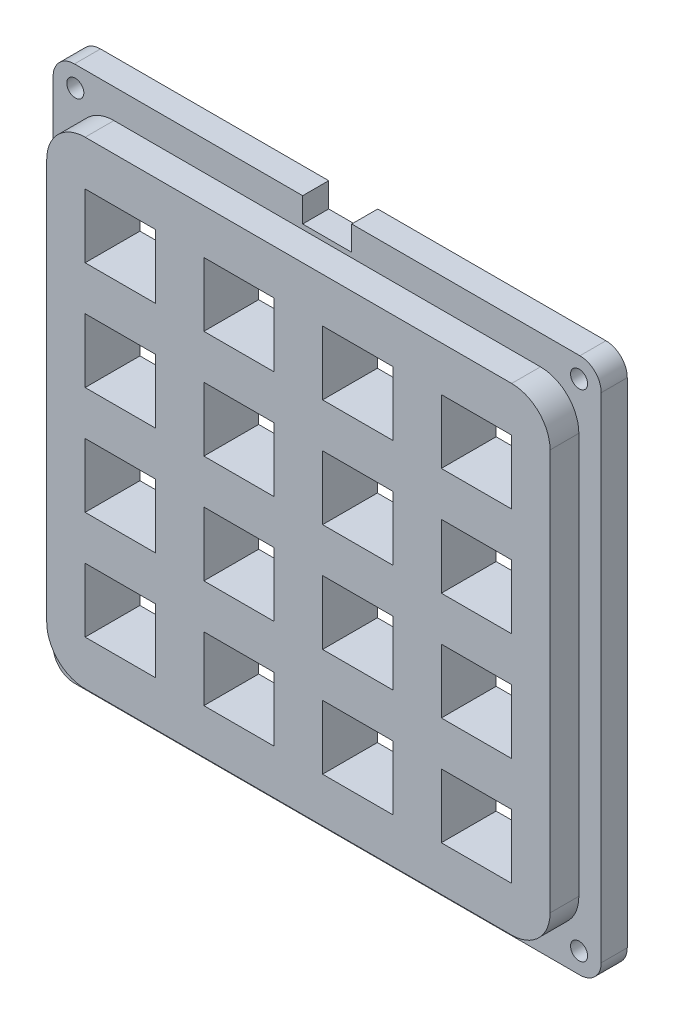
from build123d import *

# Parameters (mm, degrees)
BASE_DEPTH        = 3.0988
SKETCH4_R         = 1.016
MOUNT_HOLES_DEPTH = 46.772288808
EXTRUDE2_DEPTH    = 3.429
SKETCH3_W         = 8.382
SKETCH3_H         = 7.62
KEY_DEPTH         = 47.131464686
KEYS_COUNT        = 4
KEYS_PITCH        = 14.14018
KEYS_COUNT_DIR2   = 4
KEYS_PITCH_DIR2   = 12.869418


with BuildPart() as part:
    # Sketch1 → base (new body)
    with BuildSketch(Plane.XY):
        with BuildLine():
            Line((-2.921, 31.9405), (-30.099, 31.9405))
            ThreePointArc((-30.099, 31.9405), (-31.895051224, 31.196551224), (-32.639, 29.4005))
            Line((-32.639, 29.4005), (-32.639, -29.4005))
            ThreePointArc((-32.639, -29.4005), (-31.895051224, -31.196551224), (-30.099, -31.9405))
            Line((-30.099, -31.9405), (30.099, -31.9405))
            ThreePointArc((30.099, -31.9405), (31.895051224, -31.196551224), (32.639, -29.4005))
            Line((32.639, -29.4005), (32.639, 29.4005))
            ThreePointArc((32.639, 29.4005), (31.895051224, 31.196551224), (30.099, 31.9405))
            Line((30.099, 31.9405), (2.921, 31.9405))
            Line((2.921, 31.9405), (2.921, 29.0195))
            Line((2.921, 29.0195), (-2.921, 29.0195))
            Line((-2.921, 29.0195), (-2.921, 31.9405))
        make_face()
    extrude(amount=BASE_DEPTH)

    # Sketch4 → mount holes (cut, through all)
    with BuildSketch(Plane.XY.offset(3.0988)):
        with Locations((-30, 29.5)):
            Circle(SKETCH4_R)
        with Locations((30, 29.5)):
            Circle(SKETCH4_R)
        with Locations((30, -29.5)):
            Circle(SKETCH4_R)
        with Locations((-30, -29.5)):
            Circle(SKETCH4_R)
    extrude(amount=-MOUNT_HOLES_DEPTH, mode=Mode.SUBTRACT)

    # Sketch2 → Extrude2 (add)
    with BuildSketch(Plane.XY.offset(3.0988)):
        with BuildLine():
            Line((-25.4, 28.448), (25.4, 28.448))
            ThreePointArc((25.4, 28.448), (28.632892204, 27.108892204), (29.972, 23.876))
            Line((29.972, 23.876), (29.972, -23.876))
            ThreePointArc((29.972, -23.876), (28.632892204, -27.108892204), (25.4, -28.448))
            Line((25.4, -28.448), (-25.4, -28.448))
            ThreePointArc((-25.4, -28.448), (-28.632892204, -27.108892204), (-29.972, -23.876))
            Line((-29.972, -23.876), (-29.972, 23.876))
            ThreePointArc((-29.972, 23.876), (-28.632892204, 27.108892204), (-25.4, 28.448))
        make_face()
    extrude(amount=EXTRUDE2_DEPTH)

    # Sketch3 → key (cut, through all)
    with BuildSketch(Plane.XY.offset(6.5278)):
        with Locations((-21.209, 19.304)):
            Rectangle(SKETCH3_W, SKETCH3_H)
    key = extrude(amount=-KEY_DEPTH, mode=Mode.SUBTRACT)

    # keys: key 4 × 4
    with Locations(*[(i * KEYS_PITCH, -j * KEYS_PITCH_DIR2, 0) for i in range(KEYS_COUNT) for j in range(KEYS_COUNT_DIR2) if (i, j) != (0, 0)]):
        add(key, mode=Mode.SUBTRACT)


solid = part.part
